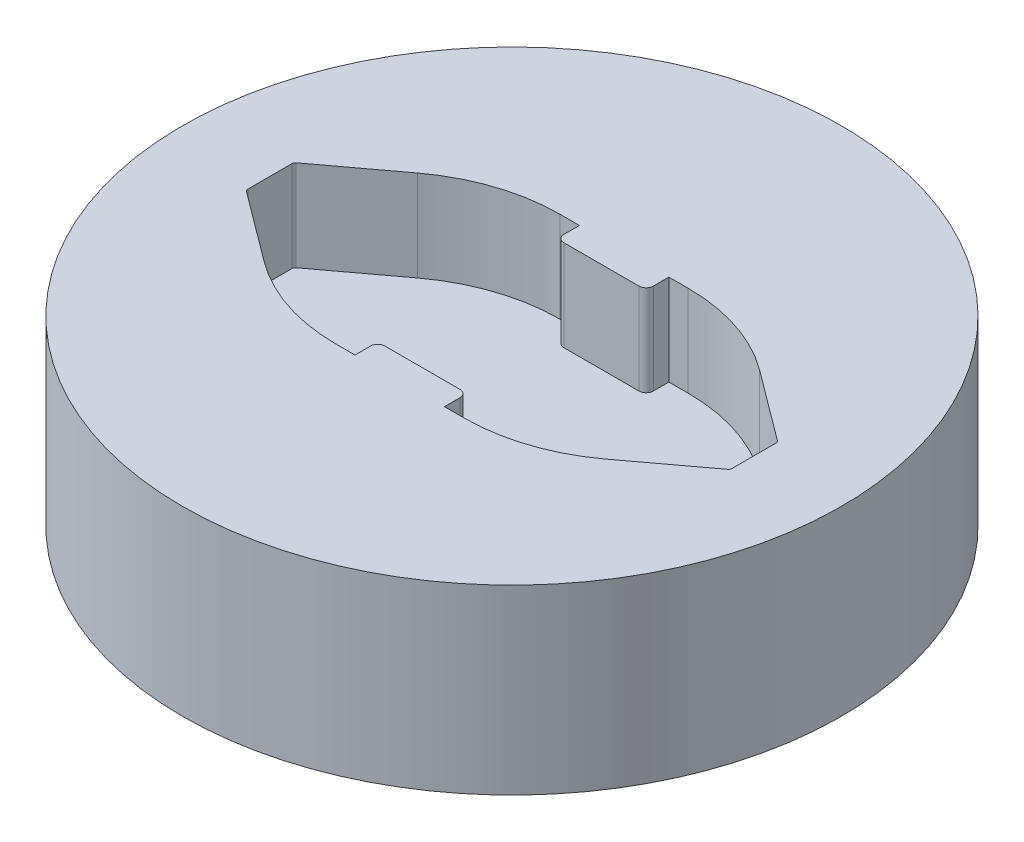
from build123d import *

# Parameters (mm, degrees)
SKETCH1_R           = 92.075
BOSS_EXTRUDE1_DEPTH = 50.8
CUT_EXTRUDE1_DEPTH  = 25.4


with BuildPart() as part:
    # Sketch1 → Boss-Extrude1 (new body)
    with BuildSketch(Plane(origin=(0, 0, 0), x_dir=(1, 0, 0), z_dir=(0, 1, 0))):
        with Locations(Location((0, 0, 0), (0, 0, 270))):
            Circle(SKETCH1_R)
    extrude(amount=BOSS_EXTRUDE1_DEPTH)

    # Sketch2 → Cut-Extrude1 (cut)
    with BuildSketch(Plane(origin=(0, 50.8, 0), x_dir=(1, 0, 0), z_dir=(0, 1, 0))):
        with BuildLine():
            Line((-67.611774054, 6.149716593), (-67.611774054, 4.988825845))
            Line((-67.611774054, 4.988825845), (-67.611774054, -4.988825845))
            Line((-67.611774054, -4.988825845), (-67.611774054, -6.149716593))
            ThreePointArc((-67.611774054, -6.149716593), (-67.505615069, -6.598100625), (-67.209677573, -6.95128467))
            Line((-67.209677573, -6.95128467), (-47.801200772, -21.428403847))
            ThreePointArc((-47.801200772, -21.428403847), (-33.655307467, -28.804821632), (-17.906024822, -31.35))
            Line((-17.906024822, -31.35), (-12.5, -31.35))
            Line((-12.5, -31.35), (-12.5, -27))
            ThreePointArc((-12.5, -27), (-11.914213562, -25.585786438), (-10.5, -25))
            Line((-10.5, -25), (-0.667840434, -25))
            Line((-0.667840434, -25), (0.667840434, -25))
            Line((0.667840434, -25), (10.5, -25))
            ThreePointArc((10.5, -25), (11.914213562, -25.585786438), (12.5, -27))
            Line((12.5, -27), (12.5, -31.35))
            Line((12.5, -31.35), (17.906024822, -31.35))
            ThreePointArc((17.906024822, -31.35), (33.655307467, -28.804821632), (47.801200772, -21.428403847))
            Line((47.801200772, -21.428403847), (67.209677573, -6.95128467))
            ThreePointArc((67.209677573, -6.95128467), (67.505615069, -6.598100625), (67.611774054, -6.149716593))
            Line((67.611774054, -6.149716593), (67.611774054, -4.988825845))
            Line((67.611774054, -4.988825845), (67.611774054, 4.988825845))
            Line((67.611774054, 4.988825845), (67.611774054, 6.149716593))
            ThreePointArc((67.611774054, 6.149716593), (67.505615069, 6.598100625), (67.209677573, 6.95128467))
            Line((67.209677573, 6.95128467), (47.801200772, 21.428403847))
            ThreePointArc((47.801200772, 21.428403847), (33.655307467, 28.804821632), (17.906024822, 31.35))
            Line((17.906024822, 31.35), (12.5, 31.35))
            Line((12.5, 31.35), (12.5, 27))
            ThreePointArc((12.5, 27), (11.914213562, 25.585786438), (10.5, 25))
            Line((10.5, 25), (0.667840434, 25))
            Line((0.667840434, 25), (-0.667840434, 25))
            Line((-0.667840434, 25), (-10.5, 25))
            ThreePointArc((-10.5, 25), (-11.914213562, 25.585786438), (-12.5, 27))
            Line((-12.5, 27), (-12.5, 31.35))
            Line((-12.5, 31.35), (-17.906024822, 31.35))
            ThreePointArc((-17.906024822, 31.35), (-33.655307467, 28.804821632), (-47.801200772, 21.428403847))
            Line((-47.801200772, 21.428403847), (-67.209677573, 6.95128467))
            ThreePointArc((-67.209677573, 6.95128467), (-67.505615069, 6.598100625), (-67.611774054, 6.149716593))
        make_face()
    extrude(amount=-CUT_EXTRUDE1_DEPTH, mode=Mode.SUBTRACT)


solid = part.part
